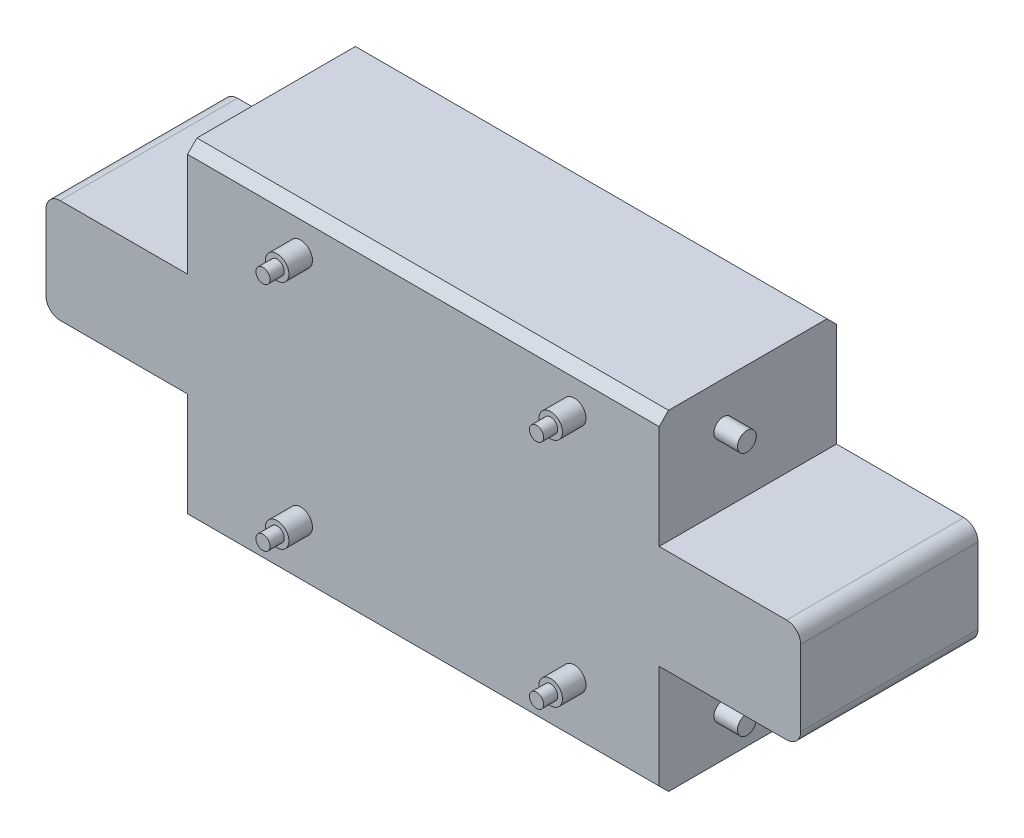
from build123d import *

# Parameters (mm, degrees)
SALIENTE_EXTRUIR1_DEPTH      = 37.6
SALIENTE_EXTRUIR2_DEPTH      = 5
SALIENTE_EXTRUIR2_DEPTH_BACK = 105
CROQUIS2_R                   = 2
REDONDEO1_R                  = 3
CHAFL_N1_SIZE                = 2
CHAFL_N2_SIZE                = 2
REDONDEO2_R                  = 3
CROQUIS3_R                   = 2.5
SALIENTE_EXTRUIR3_DEPTH      = 5
CROQUIS4_R                   = 1.5
SALIENTE_EXTRUIR4_DEPTH      = 3


with BuildPart() as part:
    # Croquis1 → Saliente-Extruir1 (new body)
    with BuildSketch(Plane.XY):
        Polygon((-62.524392651, 0.371914202), (-62.524392651, -23.628085798), (37.475607349, -23.628085798), (37.475607349, 0.371914202), (67.475607349, 0.371914202), (67.475607349, 22.371914202), (37.475607349, 22.371914202), (37.475607349, 46.371914202), (-62.524392651, 46.371914202), (-62.524392651, 22.371914202), (-92.524392651, 22.371914202), (-92.524392651, 0.371914202), align=None)
    extrude(amount=SALIENTE_EXTRUIR1_DEPTH)

    # Croquis2 → Saliente-Extruir2 (add, two sides: drawn at the far end of the back side and taken through both)
    with BuildSketch(Plane.ZY.offset(62.524392651).offset(-SALIENTE_EXTRUIR2_DEPTH_BACK)):
        with Locations((24, -14.628085798)):
            Circle(CROQUIS2_R)
        with Locations((24, 37.371914202)):
            Circle(CROQUIS2_R)
    extrude(amount=SALIENTE_EXTRUIR2_DEPTH + SALIENTE_EXTRUIR2_DEPTH_BACK)

    # Redondeo1
    redondeo1_edges = [part.edges().sort_by_distance(p)[0] for p in [
        (67.475607349, 22.371914202, 18.8),
        (67.475607349, 0.371914202, 18.8),
    ]]
    fillet(redondeo1_edges, radius=REDONDEO1_R)

    # Chaflán1
    chafl_n1_edges = [part.edges().sort_by_distance(p)[0] for p in [
        (-12.524392651, 46.371914202, 0),
        (-12.524392651, -23.628085798, 0),
    ]]
    chamfer(chafl_n1_edges, length=CHAFL_N1_SIZE)

    # Chaflán2
    chafl_n2_edges = [part.edges().sort_by_distance(p)[0] for p in [
        (-12.524392651, -23.628085798, 37.6),
        (-12.524392651, 46.371914202, 37.6),
    ]]
    chamfer(chafl_n2_edges, length=CHAFL_N2_SIZE)

    # Redondeo2
    redondeo2_edges = [part.edges().sort_by_distance(p)[0] for p in [
        (-92.524392651, 0.371914202, 18.8),
        (-92.524392651, 22.371914202, 18.8),
    ]]
    fillet(redondeo2_edges, radius=REDONDEO2_R)

    # Croquis3 → Saliente-Extruir3 (add)
    with BuildSketch(Plane.XY.offset(37.6)):
        with Locations(Location((-38.524392651, 38.121914202, 0), (0, 0, 180))):
            Circle(CROQUIS3_R)
        with Locations(Location((19.475607349, 38.121914202, 0), (0, 0, 180))):
            Circle(CROQUIS3_R)
        with Locations(Location((-38.524392651, -10.878085798, 0), (0, 0, 180))):
            Circle(CROQUIS3_R)
        with Locations(Location((19.475607349, -10.878085798, 0), (0, 0, 180))):
            Circle(CROQUIS3_R)
    extrude(amount=SALIENTE_EXTRUIR3_DEPTH)

    # Croquis4 → Saliente-Extruir4 (add)
    with BuildSketch(Plane.XY.offset(42.6)):
        with Locations((-38.524392651, 38.121914202)):
            Circle(CROQUIS4_R)
        with Locations((19.475607349, 38.121914202)):
            Circle(CROQUIS4_R)
        with Locations((-38.524392651, -10.878085798)):
            Circle(CROQUIS4_R)
        with Locations((19.475607349, -10.878085798)):
            Circle(CROQUIS4_R)
    extrude(amount=SALIENTE_EXTRUIR4_DEPTH)


solid = part.part
